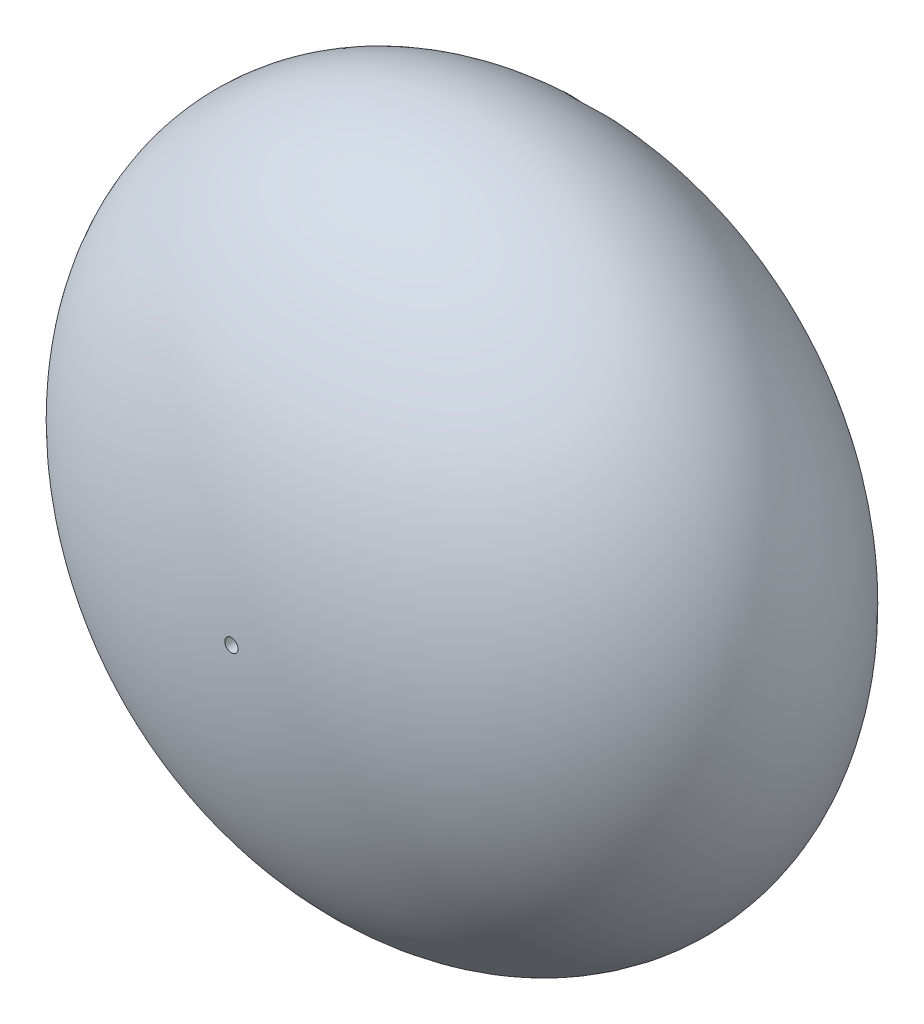
from build123d import *

# Parameters (mm, degrees)
SKETCH3_R               = 7
CUT_EXTRUDE1_DEPTH      = 13
CUT_EXTRUDE2_DEPTH      = 42.041138069
CUT_EXTRUDE2_DEPTH_BACK = 42.041138069
SKETCH4_R               = 0.5
CUT_EXTRUDE3_DEPTH      = 42.039784391
CUT_EXTRUDE3_DEPTH_BACK = 42.039784391
SKETCH5_R               = 1.5


with BuildPart() as part:
    # Sketch1 → Revolve4 (revolve)
    with BuildSketch(Plane(origin=(0, 0, 0), x_dir=(1, 0, 0), z_dir=(0, 1, 0))):
        with BuildLine():
            Line((0, 17.5), (0, -17.5))
            add(Edge.make_bspline(
                [(0, -17.5), (26.25, -17.5), (26.25, 0), (26.25, 17.5), (0, 17.5)],
                knots=[1.570796327, 1.570796327, 1.570796327, 3.141592654, 3.141592654, 4.71238898, 4.71238898, 4.71238898], degree=2, weights=[1, 0.707106781, 1, 0.707106781, 1]))
        make_face()
    revolve(axis=Axis((0, 0, -17.5), (0, 0, 1)))

    # Sketch3 → Cut-Extrude1 (cut)
    with BuildSketch(Plane.XY):
        Circle(SKETCH3_R)
    extrude(amount=CUT_EXTRUDE1_DEPTH, mode=Mode.SUBTRACT)

    # Sketch4 → Cut-Extrude2 (cut, two sides: drawn at the far end of the back side and taken through both)
    with BuildSketch(Plane.XY.offset(-CUT_EXTRUDE2_DEPTH_BACK)):
        Circle(SKETCH4_R)
    extrude(amount=CUT_EXTRUDE2_DEPTH + CUT_EXTRUDE2_DEPTH_BACK, mode=Mode.SUBTRACT)

    # Sketch5 → Cut-Extrude3 (cut, two sides: drawn at the far end of the back side and taken through both)
    with BuildSketch(Plane(origin=(0, 0, 0), x_dir=(1, 0, 0), z_dir=(0, 1, 0)).offset(-CUT_EXTRUDE3_DEPTH_BACK)):
        with Locations(Location((0, 10, 0), (0, 0, 270))):
            Circle(SKETCH5_R)
    extrude(amount=CUT_EXTRUDE3_DEPTH + CUT_EXTRUDE3_DEPTH_BACK, mode=Mode.SUBTRACT)


solid = part.part
